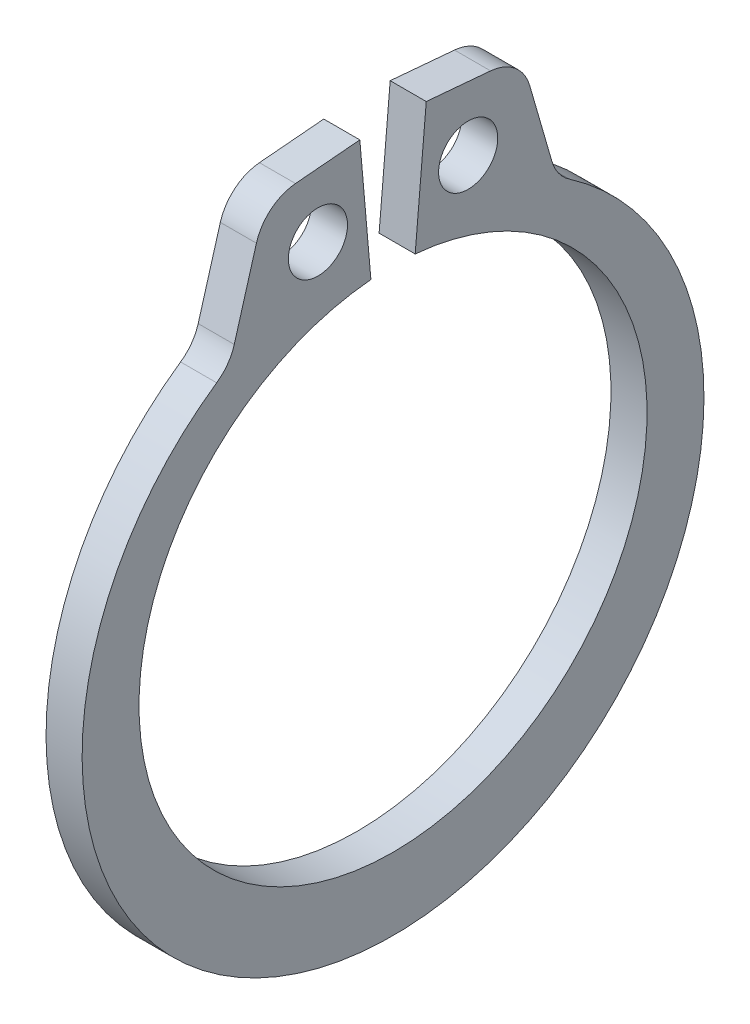
from build123d import *

# Parameters (mm, degrees)
SKETCH1_R      = 0.5207
EXTRUDE1_DEPTH = 0.3175
FILLET1_R      = 0.7874


with BuildPart() as part:
    # Sketch1 → Extrude1 (new, symmetric)
    with BuildSketch(Plane(origin=(0, 0, 0), x_dir=(0, 0, -1), z_dir=(1, 0, 0))):
        with BuildLine():
            Line((-0.389621032, 4.453388778), (-0.584431549, 6.680083168))
            Line((-0.584431549, 6.680083168), (-2.25445234, 6.53397528))
            Line((-2.25445234, 6.53397528), (-2.87534029, 4.386740502))
            ThreePointArc((-2.87534029, 4.386740502), (0, -5.7404), (2.87534029, 4.386740502))
            Line((2.87534029, 4.386740502), (2.25445234, 6.53397528))
            Line((2.25445234, 6.53397528), (0.584431549, 6.680083168))
            Line((0.584431549, 6.680083168), (0.389621032, 4.453388778))
            ThreePointArc((0.389621032, 4.453388778), (0, -4.4704), (-0.389621032, 4.453388778))
        make_face()
        with Locations((-1.322036686, 5.493682029)):
            Circle(SKETCH1_R, mode=Mode.SUBTRACT)
        with Locations((1.322036686, 5.493682029)):
            Circle(SKETCH1_R, mode=Mode.SUBTRACT)
    extrude(amount=EXTRUDE1_DEPTH, both=True)

    # Fillet1
    fillet1_edges = [part.edges().sort_by_distance(p)[0] for p in [
        (0, 6.53397528, -2.25445234),
        (0, 4.386740502, -2.87534029),
        (0, 4.386740502, 2.87534029),
        (0, 6.53397528, 2.25445234),
    ]]
    fillet(fillet1_edges, radius=FILLET1_R)


solid = part.part
